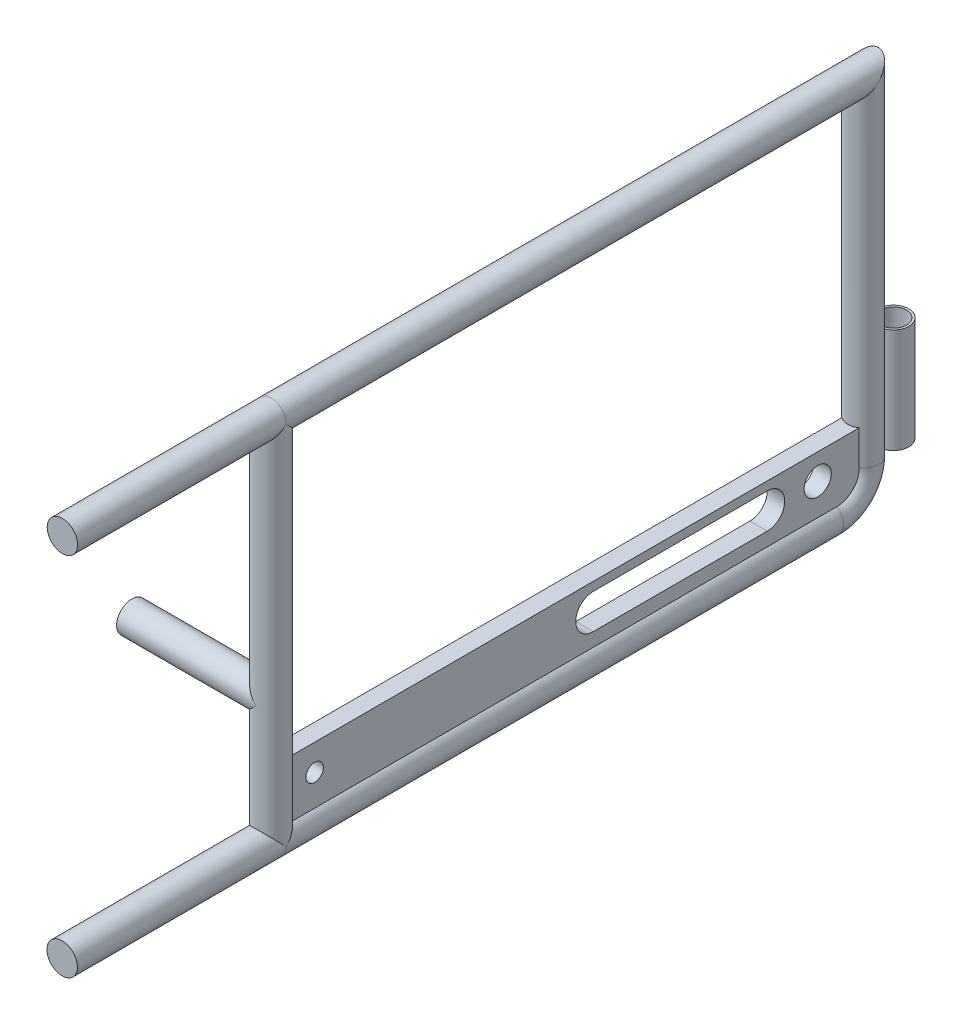
from build123d import *
from build123d.topology import SkipClean

# Parameters (mm, degrees)
SKETCH3_R               = 11.1125
SKETCH3_8_R             = 11.1125
SKETCH11_R              = 6.35
BOSS_EXTRUDE2_DEPTH     = 6.35
SKETCH12_R              = 11.1125
SKETCH12_R_2            = 9.525
BOSS_EXTRUDE3_DEPTH     = 101.6
SKETCH13_R              = 11.1125
SKETCH13_R_2            = 9.525
BOSS_EXTRUDE4_DEPTH     = 76.2
CUT_EXTRUDE1_DEPTH      = 947.041134319
CUT_EXTRUDE1_DEPTH_BACK = 947.041134319
SKETCH14_R              = 9.906


with BuildPart() as part:
    # Sweep1: sweep along a path in Sketch1
    with BuildLine(Plane(origin=(0, 0, 0), x_dir=(0, 0, -1), z_dir=(1, 0, 0))) as sweep1_path:
        Line((0, -431.8), (152.212779539, -431.8))
        Line((152.212779539, -431.8), (584.012779539, -431.8))
        Line((584.012779539, -431.8), (584.012779539, -673.1))
        ThreePointArc((584.012779539, -673.1), (576.573291781, -691.060512242), (558.612779539, -698.5))
        Line((558.612779539, -698.5), (152.212779539, -698.5))
        Line((152.212779539, -698.5), (-0.187220461, -698.5))
    # Sketch3 → Sweep1 (sweep)
    with BuildSketch(Plane.XY):
        with Locations((0, -698.5)):
            Circle(SKETCH3_R)
    sweep(path=sweep1_path.line, transition=Transition.RIGHT)

    # Sweep2: sweep along a path in Sketch1<23>
    with BuildLine(Plane(origin=(0, 0, 0), x_dir=(0, 0, -1), z_dir=(1, 0, 0))) as sweep2_path:
        Line((-0.187220461, -698.5), (152.212779539, -698.5))
        Line((152.212779539, -698.5), (152.212779539, -431.8))
    # Sketch3<8> → Sweep2 (sweep)
    with BuildSketch(Plane.XY):
        with Locations((0, -698.5)):
            Circle(SKETCH3_8_R)
    sweep(path=sweep2_path.line, transition=Transition.RIGHT)

    # Sketch11 → Boss-Extrude2 (add, symmetric)
    with BuildSketch(Plane(origin=(0, 0, 0), x_dir=(0, 0, -1), z_dir=(1, 0, 0))):
        with BuildLine():
            Line((584.012779539, -673.1), (584.012779539, -647.7))
            Line((584.012779539, -647.7), (152.212779539, -647.7))
            Line((152.212779539, -647.7), (152.212779539, -698.5))
            Line((152.212779539, -698.5), (558.612779539, -698.5))
            ThreePointArc((558.612779539, -698.5), (576.573291781, -691.060512242), (584.012779539, -673.1))
        make_face()
        with BuildLine():
            ThreePointArc((380.812779539, -679.45), (368.112779539, -666.75), (380.812779539, -654.05))
            Line((380.812779539, -654.05), (507.812779539, -654.05))
            ThreePointArc((507.812779539, -654.05), (520.512779539, -666.75), (507.812779539, -679.45))
            Line((507.812779539, -679.45), (380.812779539, -679.45))
        make_face(mode=Mode.SUBTRACT)
        with Locations((177.612779539, -666.75)):
            Circle(SKETCH11_R, mode=Mode.SUBTRACT)
    extrude(amount=BOSS_EXTRUDE2_DEPTH, both=True)

    # Sketch12 → Boss-Extrude3 (add)
    with SkipClean():  # the faces are left unmerged after this step: merging them gives an invalid solid
        with BuildSketch(Plane(origin=(0, 0, 0), x_dir=(0, 0, -1), z_dir=(1, 0, 0))):
            with Locations((152.212779539, -609.6)):
                Circle(SKETCH12_R)
            with Locations((152.212779539, -609.6)):
                Circle(SKETCH12_R_2, mode=Mode.SUBTRACT)
        extrude(amount=-BOSS_EXTRUDE3_DEPTH)

    # Sketch14 → Cut-Extrude1 (cut, two sides: drawn at the far end of the back side and taken through both)
    with SkipClean():  # the faces are left unmerged after this step: merging them gives an invalid solid
        with BuildSketch(Plane(origin=(0, 0, 0), x_dir=(0, 0, -1), z_dir=(1, 0, 0)).offset(-CUT_EXTRUDE1_DEPTH_BACK)):
            with Locations((544.591086338, -666.317306799)):
                Circle(SKETCH14_R)
        extrude(amount=CUT_EXTRUDE1_DEPTH + CUT_EXTRUDE1_DEPTH_BACK, mode=Mode.SUBTRACT)


with BuildPart() as body_2:
    # Sketch13 → Boss-Extrude4 (new body)
    with BuildSketch(Plane(origin=(0, -673.1, 0), x_dir=(1, 0, 0), z_dir=(0, 1, 0))):
        with Locations((0, 606.237779539)):
            Circle(SKETCH13_R)
        with Locations((0, 606.237779539)):
            Circle(SKETCH13_R_2, mode=Mode.SUBTRACT)
    extrude(amount=BOSS_EXTRUDE4_DEPTH)


solid = Compound([part.part, body_2.part])
